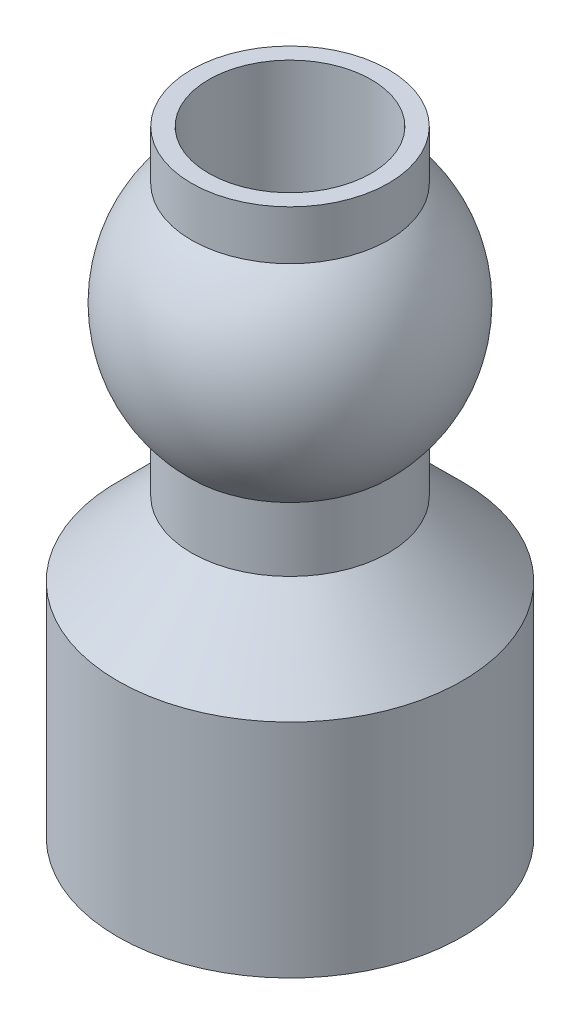
from build123d import *

# Parameters (mm, degrees)
SKETCH2_R          = 1.65
CUT_EXTRUDE1_DEPTH = 12.5


with BuildPart() as part:
    # Sketch1 → Revolve1 (revolve)
    with BuildSketch(Plane.XY, mode=Mode.PRIVATE) as revolve1_sk:
        with BuildLine():
            Line((0, 6.25), (0, -6.25))
            Line((0, -6.25), (3.5, -6.25))
            Line((3.5, -6.25), (3.5, -1.75))
            Line((3.5, -1.75), (2, -0.25))
            Line((2, -0.25), (2, 1.05))
            ThreePointArc((2, 1.05), (2.9, 3.15), (2, 5.25))
            Line((2, 5.25), (2, 6.25))
            Line((2, 6.25), (0, 6.25))
        make_face()
    revolve(revolve1_sk.sketch.rotate(Axis((0, 9.816629846, 0), (0, -1, 0)), 90), axis=Axis((0, 9.816629846, 0), (0, -1, 0)))

    # Sketch2 → Cut-Extrude1 (cut)
    with BuildSketch(Plane(origin=(0, 6.25, 0), x_dir=(1, 0, 0), z_dir=(0, 1, 0))):
        with Locations(Location((0, 0, 0), (0, 0, 270))):
            Circle(SKETCH2_R)
    extrude(amount=-CUT_EXTRUDE1_DEPTH, mode=Mode.SUBTRACT)


solid = part.part
